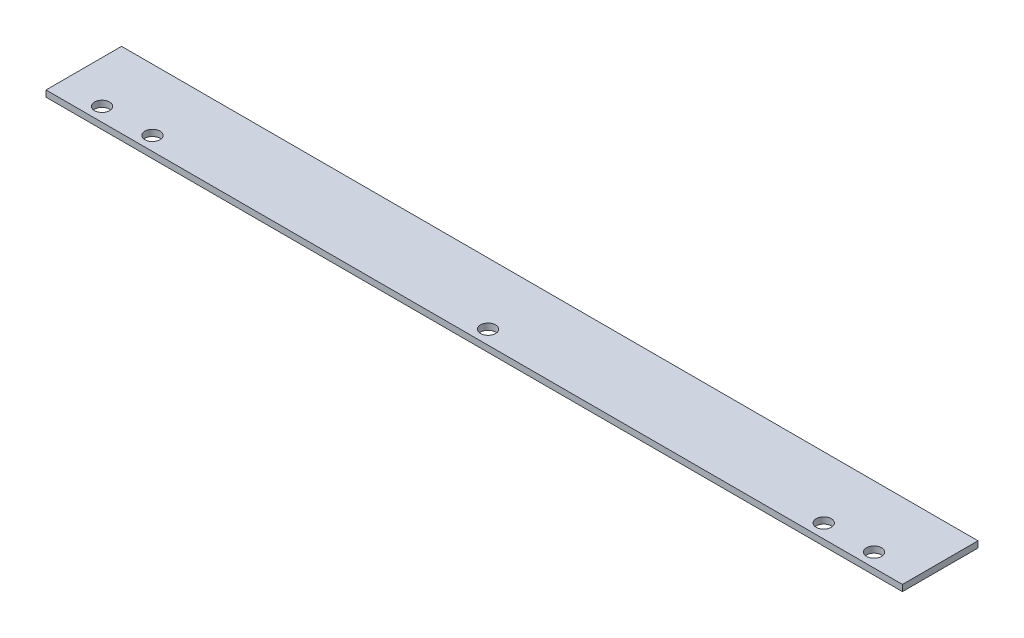
from build123d import *

# Parameters (mm, degrees)
SKETCH2_W             = 215.9
SKETCH2_H             = 19.05
BOSS_EXTRUDE1_DEPTH   = 1.5875
F_6_CLEARANCE_HOLE1_D = 3.7973


with BuildPart() as part:
    # Sketch2 → Boss-Extrude1 (new body)
    with BuildSketch(Plane(origin=(0, 0, 0), x_dir=(1, 0, 0), z_dir=(0, 1, 0))):
        Rectangle(SKETCH2_W, SKETCH2_H)
    extrude(amount=BOSS_EXTRUDE1_DEPTH)

    # #6 Clearance Hole1 (through all)
    with Locations(Plane(origin=(0, 1.5875, 0), x_dir=(1, 0, 0), z_dir=(0, 1, 0))):
        with Locations((-97.31223666, -6.034928337), (0, -6.034928337), (97.31223666, -6.034928337), (-84.61223666, -6.034928337), (84.61223666, -6.034928337)):
            Hole(F_6_CLEARANCE_HOLE1_D / 2)


solid = part.part
